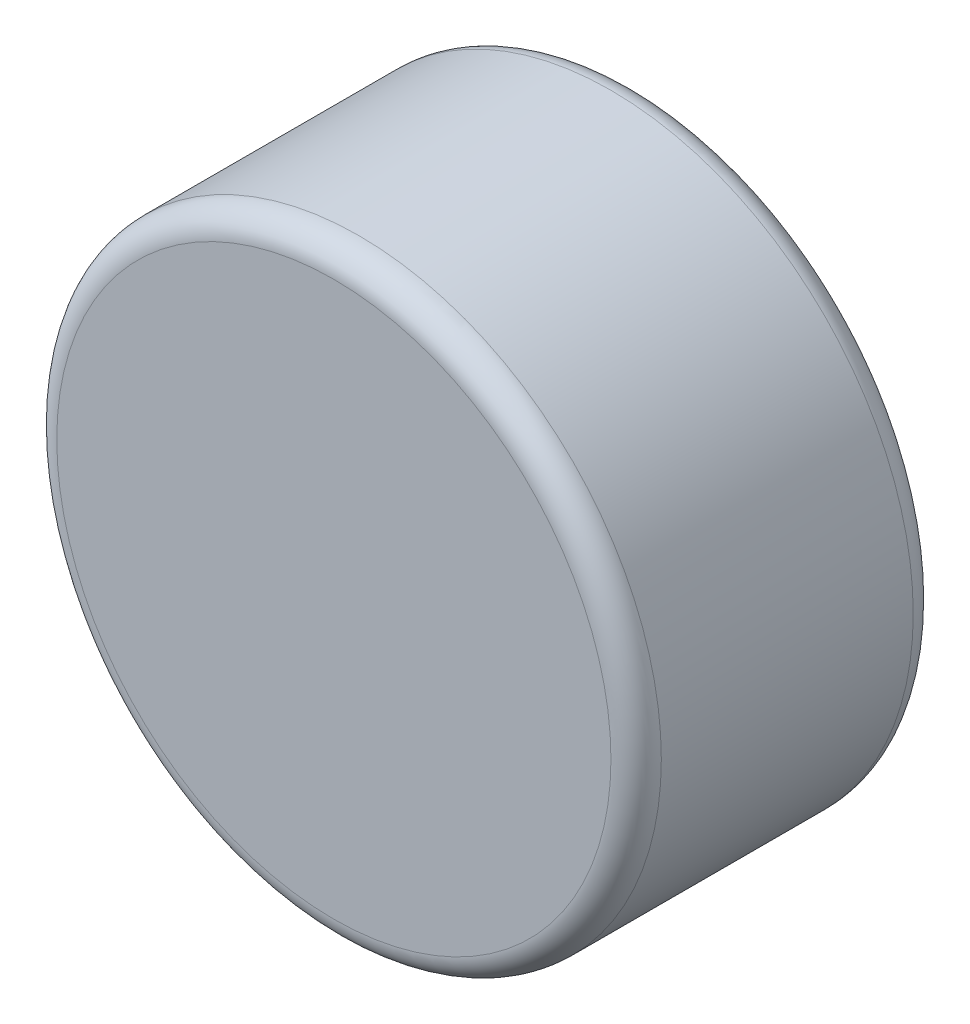
from build123d import *

# Parameters (mm, degrees)
SKETCH1_R           = 3
BOSS_EXTRUDE1_DEPTH = 3
FILLET1_R           = 0.25


with BuildPart() as part:
    # Sketch1 → Boss-Extrude1 (new body)
    with BuildSketch(Plane.XY):
        Circle(SKETCH1_R)
    extrude(amount=BOSS_EXTRUDE1_DEPTH)

    # Fillet1
    fillet1_edges = [part.edges().sort_by_distance(p)[0] for p in [
        (-3, 0, 0),
        (-3, 0, 3),
    ]]
    fillet(fillet1_edges, radius=FILLET1_R)


solid = part.part
